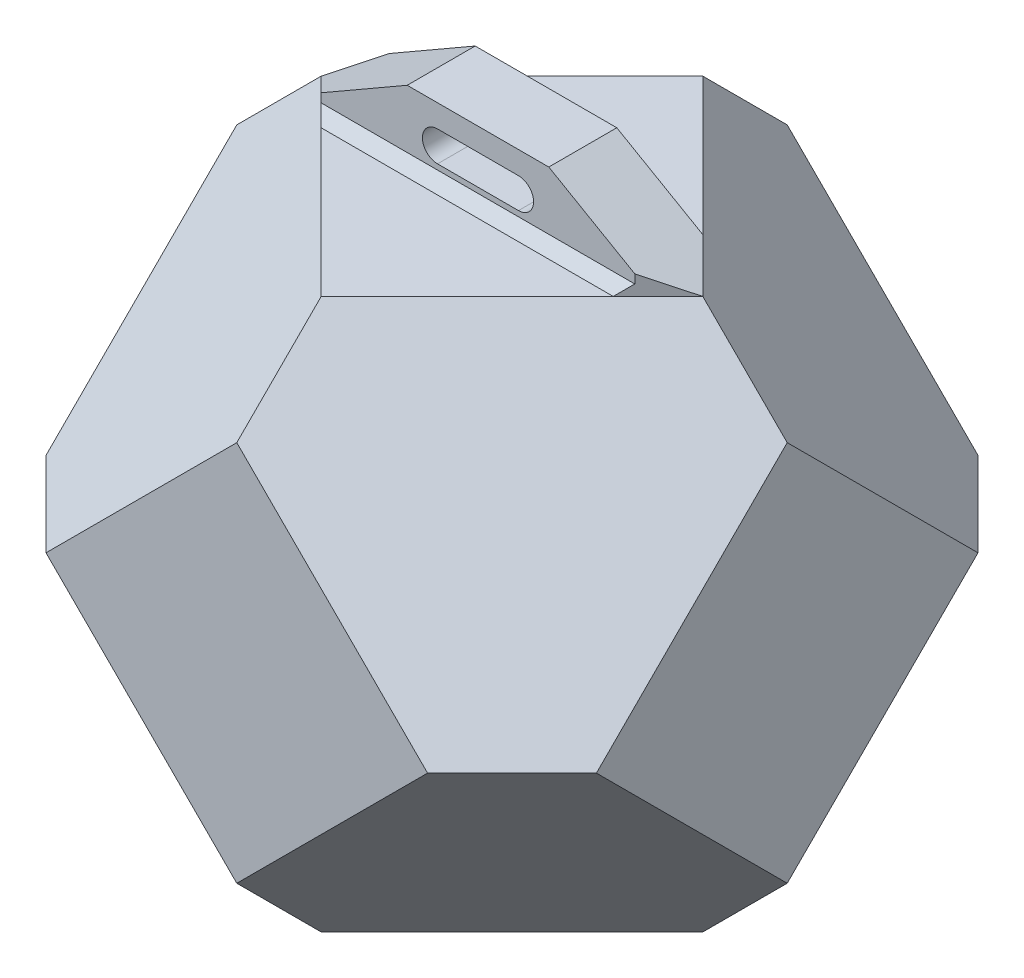
from build123d import *

# Parameters (mm, degrees)
SKETCH1_W               = 51
SKETCH1_H               = 51
BOSS_EXTRUDE1_DEPTH     = 25.5
CUT_EXTRUDE2_DEPTH      = 72.523151119
MIRROR2_COPY_1_DEPTH    = 72.523151119
MIRROR3_COPY_1_DEPTH    = 72.523151119
MIRROR3_COPY_2_DEPTH    = 72.523151119
MIRROR3_COPY_3_DEPTH    = 72.523151119
BOSS_EXTRUDE2_DEPTH     = 6.4
CHAMFER3_SIZE           = 1
CUT_EXTRUDE3_DEPTH      = 49.146754823
CUT_EXTRUDE4_DEPTH      = 49.146754823
CUT_EXTRUDE4_DEPTH_BACK = 49.146754823


with BuildPart() as part:
    # Sketch1 → Boss-Extrude1 (new, symmetric)
    with BuildSketch(Plane(origin=(0, 0, 0), x_dir=(1, 0, 0), z_dir=(0, 1, 0))):
        Rectangle(SKETCH1_W, SKETCH1_H)
    extrude(amount=BOSS_EXTRUDE1_DEPTH, both=True)

    # 3DSketch1 → Cut-Extrude2 (cut, through all)
    with BuildSketch(Plane(origin=(-25.5, 17.67766953, 0), x_dir=(0.7806979593832931, 0.18326681686473545, -0.597431142518558), z_dir=(-0.577350269189626, 0.5773502691896257, -0.5773502691896257))):
        Polygon((0, 0), (7.32146008, 23.903895547), (10.561190304, 34.481317541), (18.101641346, 26.386917868), (35.142292098, 8.094399673), (42.68274314, 0), (31.902561874, -2.483022322), (7.540451042, -8.094399673), (-3.239730224, -10.577421994), align=None)
    cut_extrude2 = extrude(amount=CUT_EXTRUDE2_DEPTH, mode=Mode.SUBTRACT)

    # Mirror1: Cut-Extrude2 across plane
    add(cut_extrude2.mirror(Plane.ZX), mode=Mode.SUBTRACT)

    # Mirror2: Cut-Extrude2 across plane
    add(cut_extrude2.mirror(Plane(origin=(0, 0, 0), x_dir=(0, 0, 1), z_dir=(1, 0, 0))), mode=Mode.SUBTRACT)

    # Mirror2 copy 1 sketch → Mirror2 copy 1 (cut, through all)
    with BuildSketch(Plane(origin=(25.5, -17.67766953, 0), x_dir=(-0.7806979593832931, -0.18326681686473545, -0.597431142518558), z_dir=(0.577350269189626, -0.5773502691896257, -0.5773502691896257))):
        Polygon((0, 0), (7.32146008, 23.903895547), (10.561190304, 34.481317541), (18.101641346, 26.386917868), (35.142292098, 8.094399673), (42.68274314, 0), (31.902561874, -2.483022322), (7.540451042, -8.094399673), (-3.239730224, -10.577421994), align=None)
    extrude(amount=MIRROR2_COPY_1_DEPTH, mode=Mode.SUBTRACT)

    # Mirror3: Cut-Extrude2 across plane
    add(cut_extrude2.mirror(Plane.XY), mode=Mode.SUBTRACT)

    # Mirror3 copy 1 sketch → Mirror3 copy 1 (cut, through all)
    with BuildSketch(Plane(origin=(-25.5, -17.67766953, 0), x_dir=(0.7806979593832931, -0.18326681686473545, 0.597431142518558), z_dir=(-0.577350269189626, -0.5773502691896257, 0.5773502691896257))):
        Polygon((0, 0), (7.32146008, 23.903895547), (10.561190304, 34.481317541), (18.101641346, 26.386917868), (35.142292098, 8.094399673), (42.68274314, 0), (31.902561874, -2.483022322), (7.540451042, -8.094399673), (-3.239730224, -10.577421994), align=None)
    extrude(amount=MIRROR3_COPY_1_DEPTH, mode=Mode.SUBTRACT)

    # Mirror3 copy 2 sketch → Mirror3 copy 2 (cut, through all)
    with BuildSketch(Plane(origin=(25.5, 17.67766953, 0), x_dir=(-0.7806979593832931, 0.18326681686473545, 0.597431142518558), z_dir=(0.577350269189626, 0.5773502691896257, 0.5773502691896257))):
        Polygon((0, 0), (7.32146008, 23.903895547), (10.561190304, 34.481317541), (18.101641346, 26.386917868), (35.142292098, 8.094399673), (42.68274314, 0), (31.902561874, -2.483022322), (7.540451042, -8.094399673), (-3.239730224, -10.577421994), align=None)
    extrude(amount=MIRROR3_COPY_2_DEPTH, mode=Mode.SUBTRACT)

    # Mirror3 copy 3 sketch → Mirror3 copy 3 (cut, through all)
    with BuildSketch(Plane(origin=(25.5, -17.67766953, 0), x_dir=(-0.7806979593832931, -0.18326681686473545, 0.597431142518558), z_dir=(0.577350269189626, -0.5773502691896257, 0.5773502691896257))):
        Polygon((0, 0), (7.32146008, -23.903895547), (10.561190304, -34.481317541), (18.101641346, -26.386917868), (35.142292098, -8.094399673), (42.68274314, 0), (31.902561874, 2.483022322), (7.540451042, 8.094399673), (-3.239730224, 10.577421994), align=None)
    extrude(amount=MIRROR3_COPY_3_DEPTH, mode=Mode.SUBTRACT)

    # Sketch6 → Boss-Extrude2 (add)
    with BuildSketch(Plane(origin=(0, 25.5, 0), x_dir=(1, 0, 0), z_dir=(0, 1, 0))):
        Polygon((-17.67766953, 0), (-14.52766953, 3.15), (14.52766953, 3.15), (17.67766953, 0), (14.52766953, -3.15), (-14.52766953, -3.15), align=None)
    extrude(amount=BOSS_EXTRUDE2_DEPTH)

    # Chamfer3
    chamfer3_edges = [part.edges().sort_by_distance(p)[0] for p in [
        (0, 25.5, -3.15),
        (0, 25.5, 3.15),
    ]]
    chamfer(chamfer3_edges, length=CHAMFER3_SIZE)

    # Sketch7 → Cut-Extrude3 (cut, symmetric)
    with BuildSketch(Plane.XY):
        Polygon((-17.67766953, 25.5), (-6.56, 31.9), (-17.67766953, 31.9), align=None)
    cut_extrude3 = extrude(amount=CUT_EXTRUDE3_DEPTH, both=True, mode=Mode.SUBTRACT)

    # Mirror4: Cut-Extrude3 across plane
    add(cut_extrude3.mirror(Plane(origin=(0, 0, 0), x_dir=(0, 0, 1), z_dir=(1, 0, 0))), mode=Mode.SUBTRACT)

    # Sketch8 → Cut-Extrude4 (cut, two sides: drawn at the far end of the back side and taken through both)
    with BuildSketch(Plane.XY.offset(-CUT_EXTRUDE4_DEPTH_BACK)):
        with BuildLine():
            Line((-3.75, 29.8), (3.75, 29.8))
            ThreePointArc((3.75, 29.8), (5.15, 28.4), (3.75, 27))
            Line((3.75, 27), (-3.75, 27))
            ThreePointArc((-3.75, 27), (-5.15, 28.4), (-3.75, 29.8))
        make_face()
    extrude(amount=CUT_EXTRUDE4_DEPTH + CUT_EXTRUDE4_DEPTH_BACK, mode=Mode.SUBTRACT)


solid = part.part
